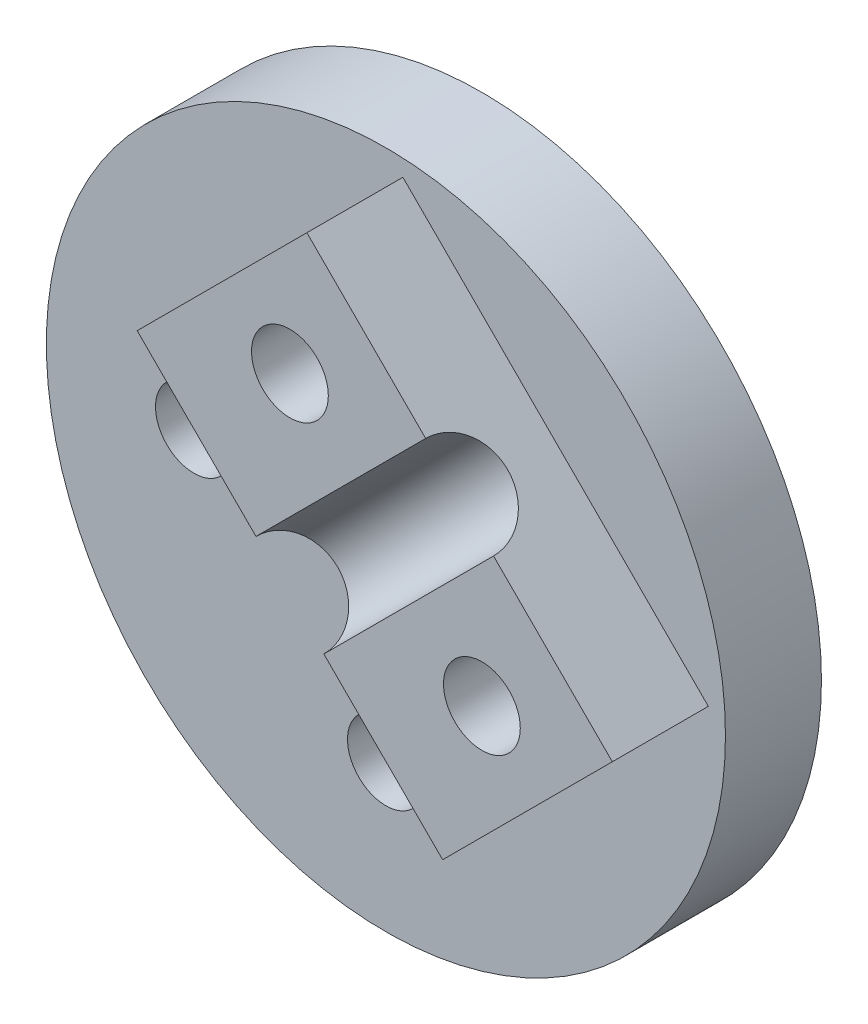
from build123d import *

# Parameters (mm, degrees)
SKETCH_1_R          = 14.149308539
SKETCH_1_R_2        = 1.6
EXTRUDE_1_DEPTH     = 4
EXTRUDE_2_DEPTH     = 10
CUT_EXTRUDE_START   = -10
SKETCH_4_R          = 1.6
CUT_EXTRUDE_1_DEPTH = 10


with BuildPart() as part:
    # 草图1 → 凸台-拉伸1 (new body)
    with BuildSketch(Plane.XY):
        Circle(SKETCH_1_R)
        with Locations((0, -8)):
            Circle(SKETCH_1_R_2, mode=Mode.SUBTRACT)
        with Locations((8, 0)):
            Circle(SKETCH_1_R_2, mode=Mode.SUBTRACT)
        with Locations((0, 8)):
            Circle(SKETCH_1_R_2, mode=Mode.SUBTRACT)
        with Locations((-8, 0)):
            Circle(SKETCH_1_R_2, mode=Mode.SUBTRACT)
    extrude(amount=EXTRUDE_1_DEPTH)

    # 草图3 → 凸台-拉伸2 (add)
    with BuildSketch(Plane(origin=(0, 0, 0), x_dir=(0, 0, -1), z_dir=(0.7071067811865488, 0.7071067811865464, 0))):
        with BuildLine():
            Line((-8, 9), (-8, 2))
            ThreePointArc((-8, 2), (-6.585786438, 1.414213562), (-6, 0))
            ThreePointArc((-6, 0), (-6.585786438, -1.414213562), (-8, -2))
            Line((-8, -2), (-8, -9))
            Line((-8, -9), (-4, -9))
            Line((-4, -9), (-4, 9))
            Line((-4, 9), (-8, 9))
        make_face()
    extrude(amount=EXTRUDE_2_DEPTH)

    # 草图4 → 切除-拉伸1 (cut)
    with BuildSketch(Plane.XY.offset(8).offset(CUT_EXTRUDE_START)):
        with Locations((8, 0)):
            Circle(SKETCH_4_R)
        with Locations((0, 8)):
            Circle(SKETCH_4_R)
    extrude(amount=CUT_EXTRUDE_1_DEPTH, mode=Mode.SUBTRACT)


solid = part.part
